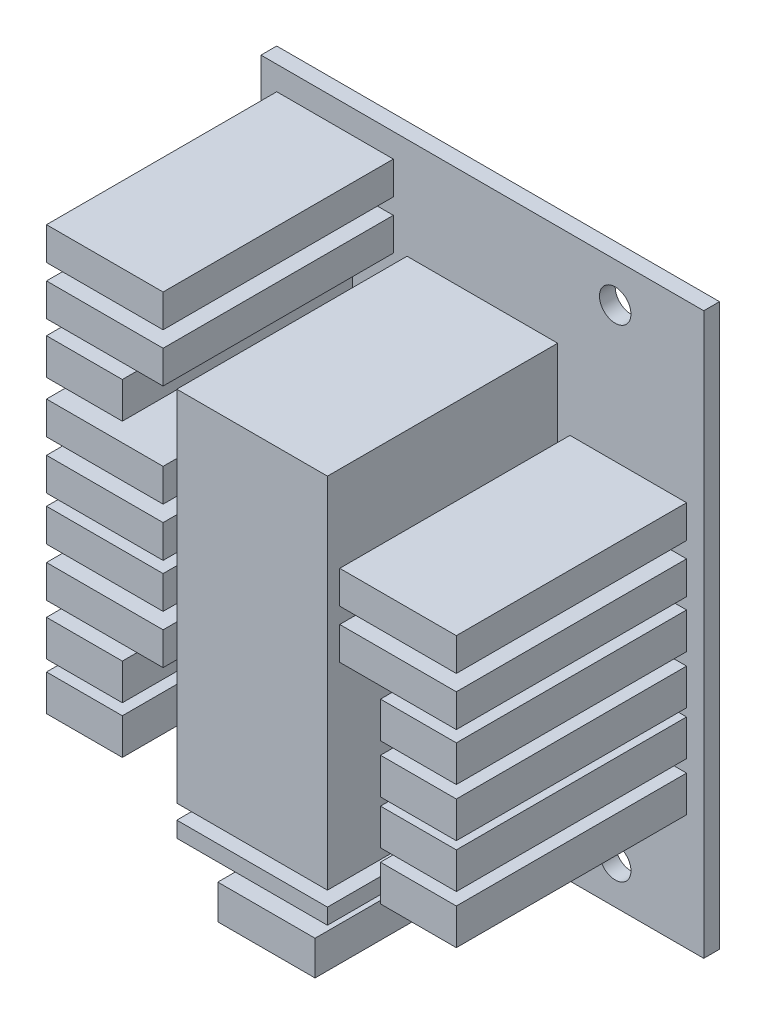
from build123d import *

# Parameters (mm, degrees)
ESQUISSE1_W        = 45
ESQUISSE1_H        = 57
ESQUISSE1_R        = 1.6
BOSS_EXTRU_1_DEPTH = 1.6
ESQUISSE2_W        = 11.850194894
ESQUISSE2_H        = 3.329778143
ESQUISSE2_W_2      = 15.310163146
ESQUISSE2_H_2      = 36.439531762
ESQUISSE2_H_3      = 1.59771523
ESQUISSE2_W_3      = 9.88221832
ESQUISSE2_H_4      = 3.500525205
ESQUISSE2_W_4      = 7.70708484
ESQUISSE2_H_5      = 3.6703264
ESQUISSE2_H_6      = 3.670326401
ESQUISSE2_W_5      = 11.850194895
BOSS_EXTRU_2_DEPTH = 23.4


with BuildPart() as part:
    # Esquisse1 → Boss.-Extru.1 (new body)
    with BuildSketch(Plane.XY):
        Rectangle(ESQUISSE1_W, ESQUISSE1_H)
        with Locations(Location((13.5, 24.5, 0), (0, 0, 180))):
            Circle(ESQUISSE1_R, mode=Mode.SUBTRACT)
        with Locations((13.5, -24.5)):
            Circle(ESQUISSE1_R, mode=Mode.SUBTRACT)
        with Locations((-9.5, -24.5)):
            Circle(ESQUISSE1_R, mode=Mode.SUBTRACT)
    extrude(amount=BOSS_EXTRU_1_DEPTH)

    # Esquisse2 → Boss.-Extru.2 (add)
    with BuildSketch(Plane.XY.offset(1.6)):
        with Locations((14.82837193, 4.125238088)):
            Rectangle(ESQUISSE2_W, ESQUISSE2_H)
        Rectangle(ESQUISSE2_W_2, ESQUISSE2_H_2)
        with Locations((0, -20.508898976)):
            Rectangle(ESQUISSE2_W_2, ESQUISSE2_H_3)
        with Locations((14.82837193, 9.066341161)):
            Rectangle(ESQUISSE2_W, ESQUISSE2_H)
        with Locations((1.45328533, -24.82991901)):
            Rectangle(ESQUISSE2_W_3, ESQUISSE2_H_4)
        with Locations((16.899926957, -0.541039394)):
            Rectangle(ESQUISSE2_W_4, ESQUISSE2_H_5)
        with Locations((16.899926957, -5.483268114)):
            Rectangle(ESQUISSE2_W_4, ESQUISSE2_H_5)
        with Locations((16.899926957, -9.959457009)):
            Rectangle(ESQUISSE2_W_4, ESQUISSE2_H_5)
        with Locations((16.899926957, -14.89838332)):
            Rectangle(ESQUISSE2_W_4, ESQUISSE2_H_6)
        with Locations((-14.971381513, 24.411505641)):
            Rectangle(ESQUISSE2_W_5, ESQUISSE2_H)
        with Locations((-17.042936541, 14.467204765)):
            Rectangle(ESQUISSE2_W_4, ESQUISSE2_H_5)
        with Locations((-14.971381513, 19.461546453)):
            Rectangle(ESQUISSE2_W_5, ESQUISSE2_H)
        with Locations((-14.971381513, 9.066341161)):
            Rectangle(ESQUISSE2_W_5, ESQUISSE2_H)
        with Locations((-14.971381513, 4.116381974)):
            Rectangle(ESQUISSE2_W_5, ESQUISSE2_H)
        with Locations((-14.971381513, -0.370765265)):
            Rectangle(ESQUISSE2_W_5, ESQUISSE2_H)
        with Locations((-14.971381513, -5.320724453)):
            Rectangle(ESQUISSE2_W_5, ESQUISSE2_H)
        with Locations((-17.042936541, -10.31506614)):
            Rectangle(ESQUISSE2_W_4, ESQUISSE2_H_5)
        with Locations((-17.042936541, -15.126670853)):
            Rectangle(ESQUISSE2_W_4, ESQUISSE2_H_5)
    extrude(amount=BOSS_EXTRU_2_DEPTH)


solid = part.part
